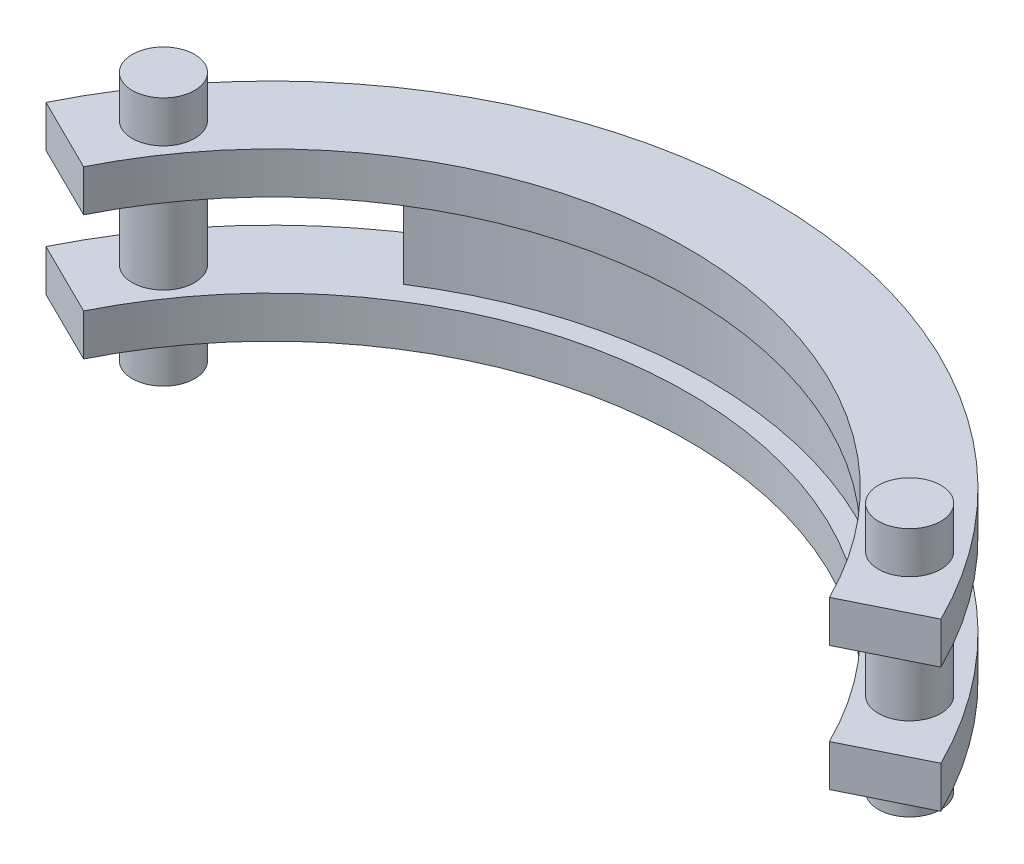
from build123d import *

# Parameters (mm, degrees)
BOSS_EXTRUDE1_DEPTH      = 10
BOSS_EXTRUDE2_DEPTH      = 10
BOSS_EXTRUDE3_DEPTH      = 10
BOSS_EXTRUDE3_DEPTH_BACK = 50
SKETCH3_R                = 7.5


with BuildPart() as part:
    # Sketch1 → Boss-Extrude1 (new body)
    with BuildSketch(Plane(origin=(0, 0, 0), x_dir=(1, 0, 0), z_dir=(0, 1, 0))):
        with BuildLine():
            Line((-107.529653027, 53.267004046), (-89.608044189, 44.389170038))
            ThreePointArc((-89.608044189, 44.389170038), (-0.97130255, 99.995282746), (88.728870826, 46.121442756))
            Line((88.728870826, 46.121442756), (106.474644991, 55.345731307))
            ThreePointArc((106.474644991, 55.345731307), (-1.16556306, 119.994339295), (-107.529653027, 53.267004046))
        make_face()
    extrude(amount=BOSS_EXTRUDE1_DEPTH)

    # Sketch2 → Boss-Extrude2 (add)
    with BuildSketch(Plane(origin=(0, 10, 0), x_dir=(1, 0, 0), z_dir=(0, 1, 0))):
        with BuildLine():
            Line((-62.097280291, 96.793221769), (-56.697516787, 88.376419876))
            ThreePointArc((-56.697516787, 88.376419876), (0, 105), (56.697516787, 88.376419876))
            Line((56.697516787, 88.376419876), (62.097280291, 96.793221769))
            ThreePointArc((62.097280291, 96.793221769), (0, 115), (-62.097280291, 96.793221769))
        make_face()
    extrude(amount=BOSS_EXTRUDE2_DEPTH)

    # Mirror1: part across plane


with BuildPart() as part_1:
    add(part.part)
    add(part.part.mirror(Plane.ZX.offset(20)))

    # Sketch3 → Boss-Extrude3 (add, two sides: drawn at the far end of the back side and taken through both)
    with BuildSketch(Plane.XZ.offset(-BOSS_EXTRUDE3_DEPTH_BACK)):
        with Locations(Location((-89.658117345, -63.616209095, 0), (0, 0, 270))):
            Circle(SKETCH3_R)
    extrude(amount=BOSS_EXTRUDE3_DEPTH + BOSS_EXTRUDE3_DEPTH_BACK)

    # Mirror2: part across plane


with BuildPart() as part_2:
    add(part_1.part)
    add(part_1.part.mirror(Plane(origin=(0, 0, 0), x_dir=(0, 0, 1), z_dir=(1, 0, 0))))


solid = part_2.part
